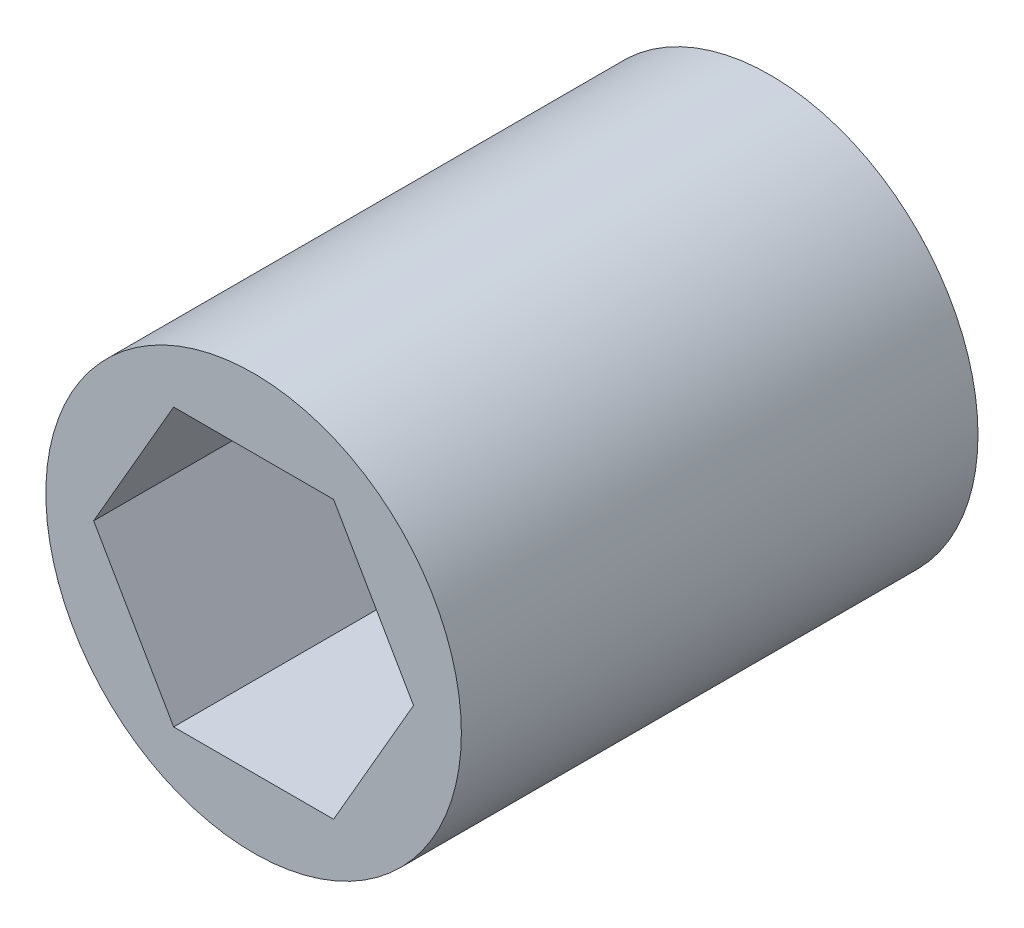
from build123d import *

# Parameters (mm, degrees)
SKETCH1_R           = 9.525
BOSS_EXTRUDE1_DEPTH = 23.6855


with BuildPart() as part:
    # Sketch1 → Boss-Extrude1 (new body)
    with BuildSketch(Plane.XY):
        Circle(SKETCH1_R)
        Polygon((7.332348419, 0), (3.666174209, 6.35), (-3.666174209, 6.35), (-7.332348419, 0), (-3.666174209, -6.35), (3.666174209, -6.35), align=None, mode=Mode.SUBTRACT)
    extrude(amount=BOSS_EXTRUDE1_DEPTH)


solid = part.part
